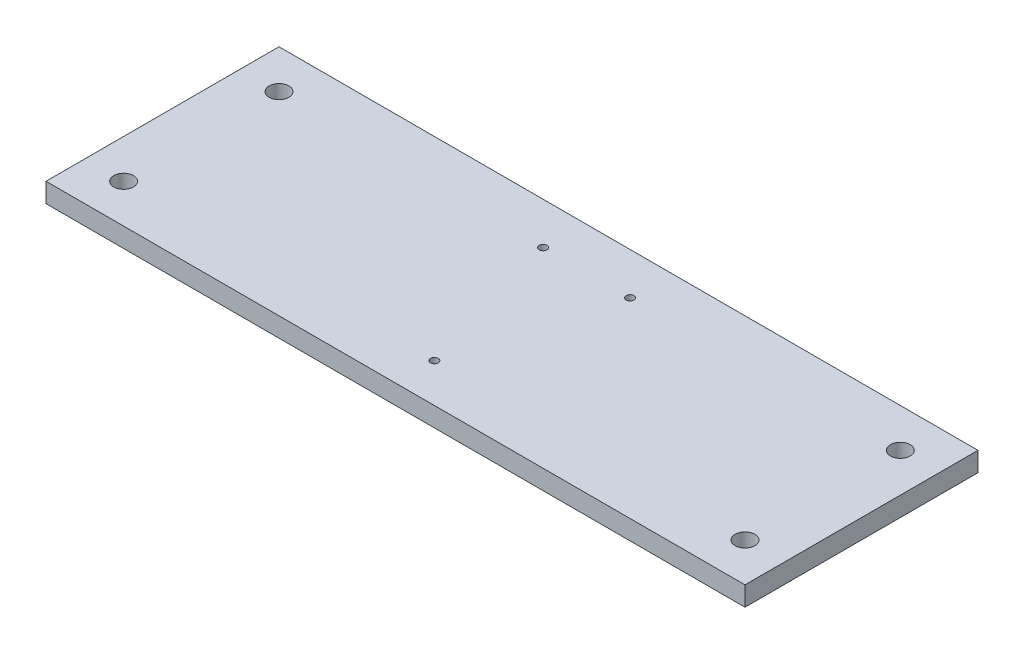
from build123d import *

# Parameters (mm, degrees)
SKETCH1_W           = 228.6
SKETCH1_H           = 76.2
SKETCH1_R           = 1.27
SKETCH1_R_2         = 3.228072168
BOSS_EXTRUDE1_DEPTH = 6.35


with BuildPart() as part:
    # Sketch1 → Boss-Extrude1 (new body)
    with BuildSketch(Plane(origin=(0, 0, 0), x_dir=(1, 0, 0), z_dir=(0, 1, 0))):
        Rectangle(SKETCH1_W, SKETCH1_H)
        with Locations(Location((-14.226267712, 24.39416, 0), (0, 0, 270))):
            Circle(SKETCH1_R, mode=Mode.SUBTRACT)
        with Locations(Location((14.226267712, 24.39416, 0), (0, 0, 270))):
            Circle(SKETCH1_R, mode=Mode.SUBTRACT)
        with Locations(Location((0, -25.4, 0), (0, 0, 270))):
            Circle(SKETCH1_R, mode=Mode.SUBTRACT)
        with Locations(Location((-101.6, 25.4, 0), (0, 0, 270))):
            Circle(SKETCH1_R_2, mode=Mode.SUBTRACT)
        with Locations(Location((101.6, 25.4, 0), (0, 0, 270))):
            Circle(SKETCH1_R_2, mode=Mode.SUBTRACT)
        with Locations(Location((101.6, -25.4, 0), (0, 0, 270))):
            Circle(SKETCH1_R_2, mode=Mode.SUBTRACT)
        with Locations(Location((-101.6, -25.4, 0), (0, 0, 270))):
            Circle(SKETCH1_R_2, mode=Mode.SUBTRACT)
    extrude(amount=BOSS_EXTRUDE1_DEPTH)


solid = part.part
